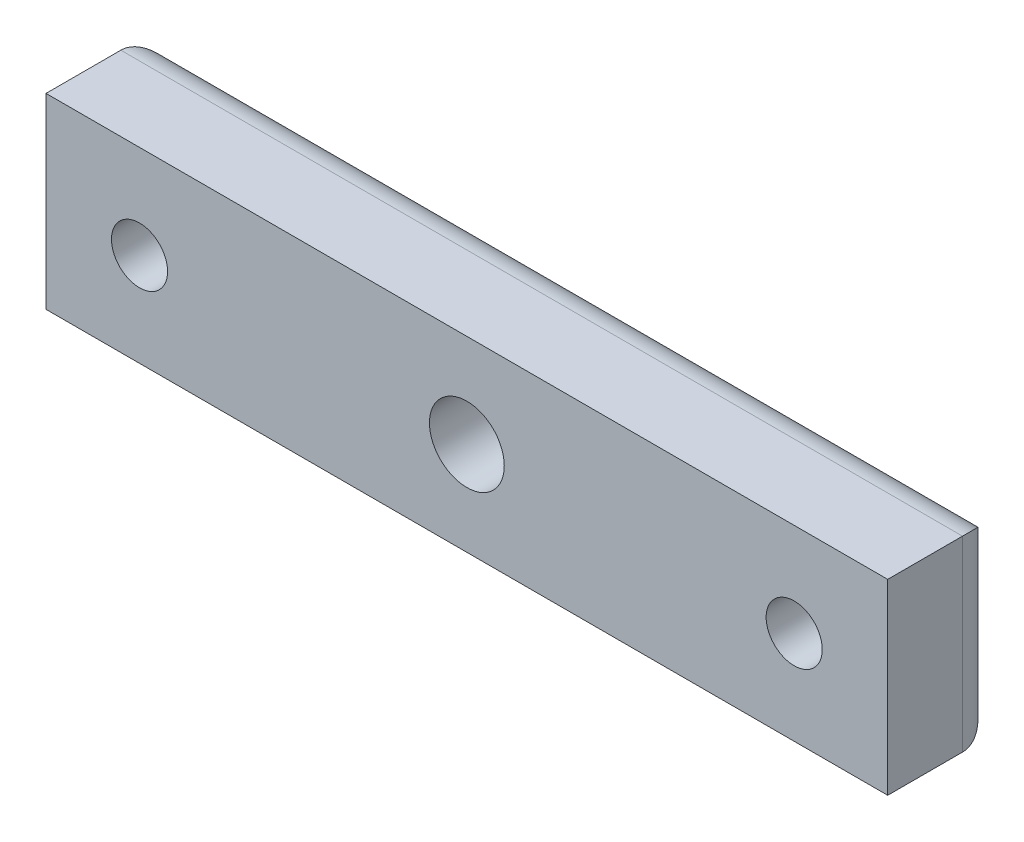
from build123d import *

# Parameters (mm, degrees)
ESQUISSE1_W        = 45
ESQUISSE1_H        = 10
ESQUISSE1_R        = 1.5
ESQUISSE1_R_2      = 2
BOSS_EXTRU_1_DEPTH = 6
CONG_1_R           = 2


with BuildPart() as part:
    # Esquisse1 → Boss.-Extru.1 (new body)
    with BuildSketch(Plane.XY):
        with Locations((22.5, 5)):
            Rectangle(ESQUISSE1_W, ESQUISSE1_H)
        with Locations((5, 5)):
            Circle(ESQUISSE1_R, mode=Mode.SUBTRACT)
        with Locations((22.5, 5)):
            Circle(ESQUISSE1_R_2, mode=Mode.SUBTRACT)
        with Locations((40, 5)):
            Circle(ESQUISSE1_R, mode=Mode.SUBTRACT)
    extrude(amount=BOSS_EXTRU_1_DEPTH)

    # Congé1
    cong_1_edges = [part.edges().sort_by_distance(p)[0] for p in [
        (22.5, 10, 0),
        (45, 5, 0),
        (22.5, 0, 0),
        (0, 5, 0),
    ]]
    fillet(cong_1_edges, radius=CONG_1_R)


solid = part.part
